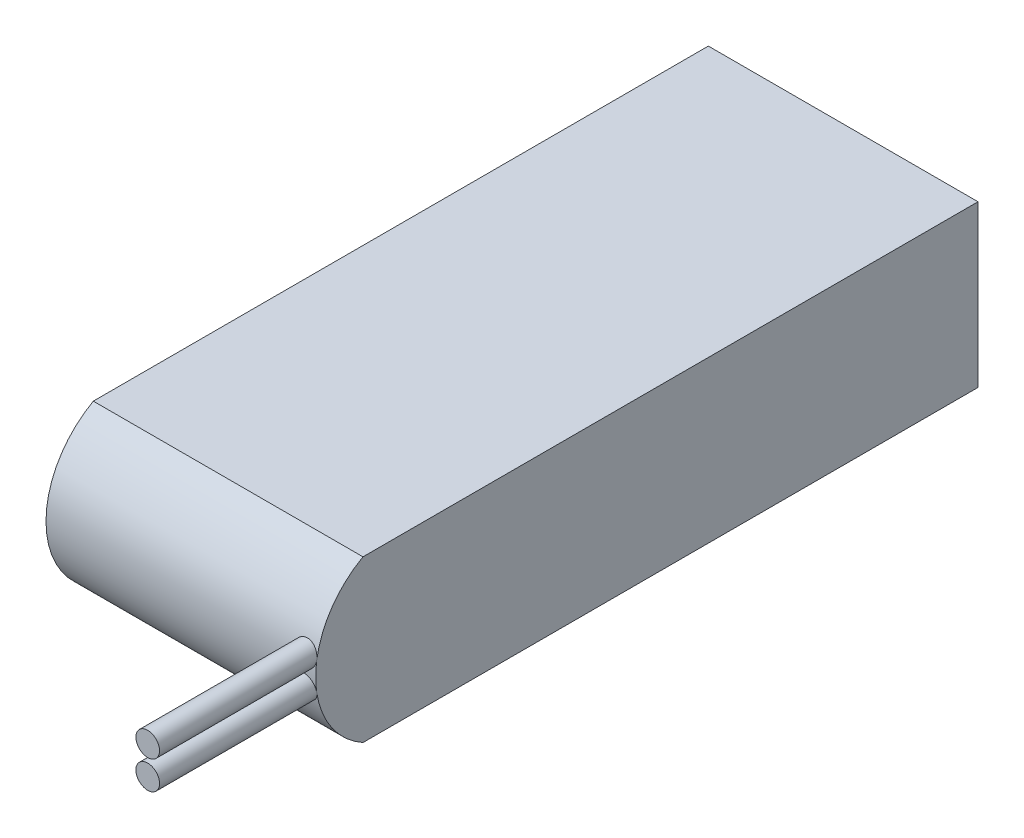
from build123d import *

# Parameters (mm, degrees)
ESQUISSE1_W        = 57
ESQUISSE1_H        = 34
BOSS_EXTRU_1_DEPTH = 130
BOSS_EXTRU_2_DEPTH = 57
ESQUISSE3_R        = 2.5
BOSS_EXTRU_3_DEPTH = 173


with BuildPart() as part:
    # Esquisse1 → Boss.-Extru.1 (new body)
    with BuildSketch(Plane.XY):
        with Locations((28.5, 17)):
            Rectangle(ESQUISSE1_W, ESQUISSE1_H)
    extrude(amount=BOSS_EXTRU_1_DEPTH)

    # Esquisse2 → Boss.-Extru.2 (add)
    with BuildSketch(Plane(origin=(57, 0, 0), x_dir=(0, 0, -1), z_dir=(1, 0, 0))):
        with BuildLine():
            Line((-130, 34), (-130, 0))
            ThreePointArc((-130, 0), (-140, 17), (-130, 34))
        make_face()
    extrude(amount=-BOSS_EXTRU_2_DEPTH)

    # Esquisse3 → Boss.-Extru.3 (add)
    with BuildSketch(Plane(origin=(0, 0, 0), x_dir=(-1, 0, 0), z_dir=(0, 0, -1))):
        with Locations((-54.5, 20)):
            Circle(ESQUISSE3_R)
        with Locations((-54.5, 14)):
            Circle(ESQUISSE3_R)
    extrude(amount=-BOSS_EXTRU_3_DEPTH)


solid = part.part
